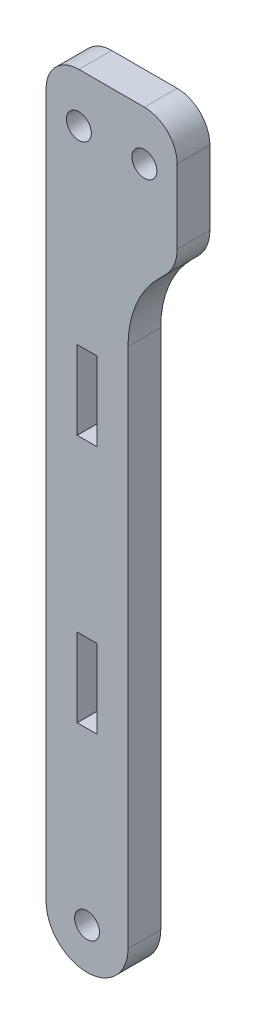
from build123d import *

# Parameters (mm, degrees)
ESQUISSE1_R        = 1.9
ESQUISSE1_W        = 3
ESQUISSE1_H        = 12
BOSS_EXTRU_1_DEPTH = 5


with BuildPart() as part:
    # Esquisse1 → Boss.-Extru.1 (new body)
    with BuildSketch(Plane.XY):
        with BuildLine():
            Line((-6.95859236, 59.924430221), (3.04140764, 59.924430221))
            ThreePointArc((3.04140764, 59.924430221), (6.576941546, 58.459964127), (8.04140764, 54.924430221))
            Line((8.04140764, 54.924430221), (8.04140764, 43.659711595))
            ThreePointArc((8.04140764, 43.659711595), (7.584684835, 41.363611001), (6.284048327, 39.417070908))
            Line((6.284048327, 39.417070908), (5.227699141, 38.360721722))
            ThreePointArc((5.227699141, 38.360721722), (1.75933512, 33.169948141), (0.54140764, 27.047013223))
            Line((0.54140764, 27.047013223), (0.54140764, -52.575569779))
            ThreePointArc((0.54140764, -52.575569779), (-5.70859236, -58.825569779), (-11.95859236, -52.575569779))
            Line((-11.95859236, -52.575569779), (-11.95859236, 54.924430221))
            ThreePointArc((-11.95859236, 54.924430221), (-10.494126266, 58.459964127), (-6.95859236, 59.924430221))
        make_face()
        with Locations((-5.70859236, -52.575569779)):
            Circle(ESQUISSE1_R, mode=Mode.SUBTRACT)
        with Locations((3.04140764, 52.424430221)):
            Circle(ESQUISSE1_R, mode=Mode.SUBTRACT)
        with Locations((-6.95859236, 52.424430221)):
            Circle(ESQUISSE1_R, mode=Mode.SUBTRACT)
        with Locations((-5.70859236, 17.424430221)):
            Rectangle(ESQUISSE1_W, ESQUISSE1_H, mode=Mode.SUBTRACT)
        with Locations((-5.70859236, -20.575569779)):
            Rectangle(ESQUISSE1_W, ESQUISSE1_H, mode=Mode.SUBTRACT)
    extrude(amount=BOSS_EXTRU_1_DEPTH)


solid = part.part
